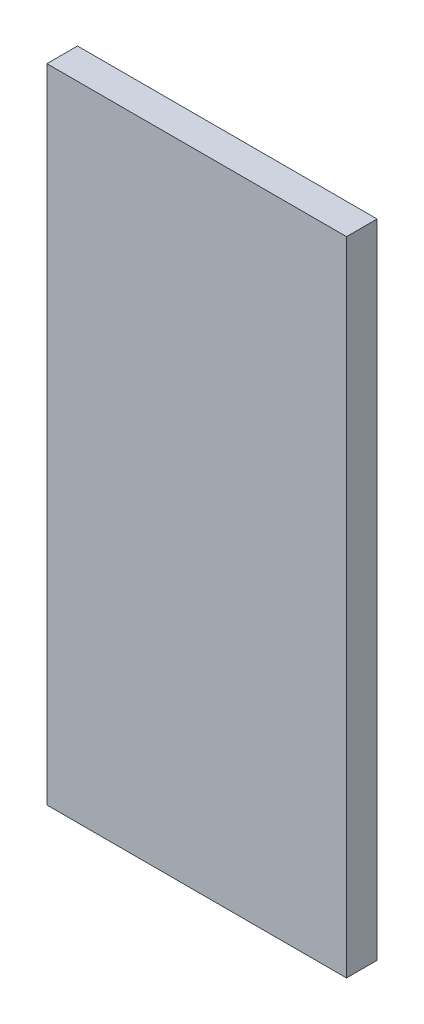
from build123d import *

# Parameters (mm, degrees)
SKETCH_1_W      = 196
SKETCH_1_H      = 420
EXTRUDE_1_DEPTH = 20


with BuildPart() as part:
    # 草图1 → 凸台-拉伸1 (new body)
    with BuildSketch(Plane.XY):
        Rectangle(SKETCH_1_W, SKETCH_1_H)
    extrude(amount=EXTRUDE_1_DEPTH)


solid = part.part
